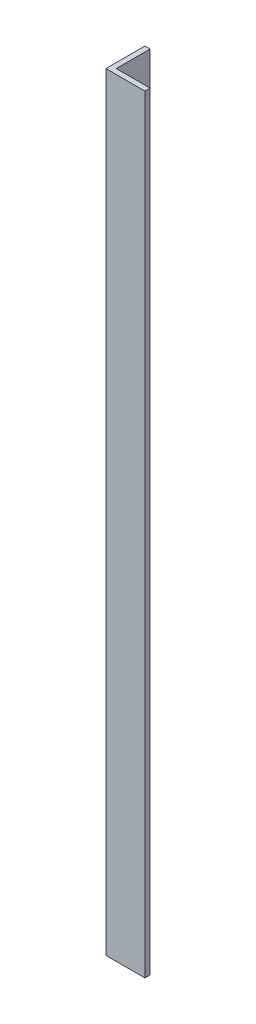
from build123d import *

# Parameters (mm, degrees)
AUFSATZ_LINEAR_AUSTRAGEN1_DEPTH = 295


with BuildPart() as part:
    # Skizze1 → Aufsatz-Linear austragen1 (new body)
    with BuildSketch(Plane(origin=(0, 0, 0), x_dir=(1, 0, 0), z_dir=(0, 1, 0))):
        Polygon((0, 0), (15, 0), (15, 2), (2, 2), (2, 15), (0, 15), align=None)
    extrude(amount=AUFSATZ_LINEAR_AUSTRAGEN1_DEPTH)


solid = part.part
